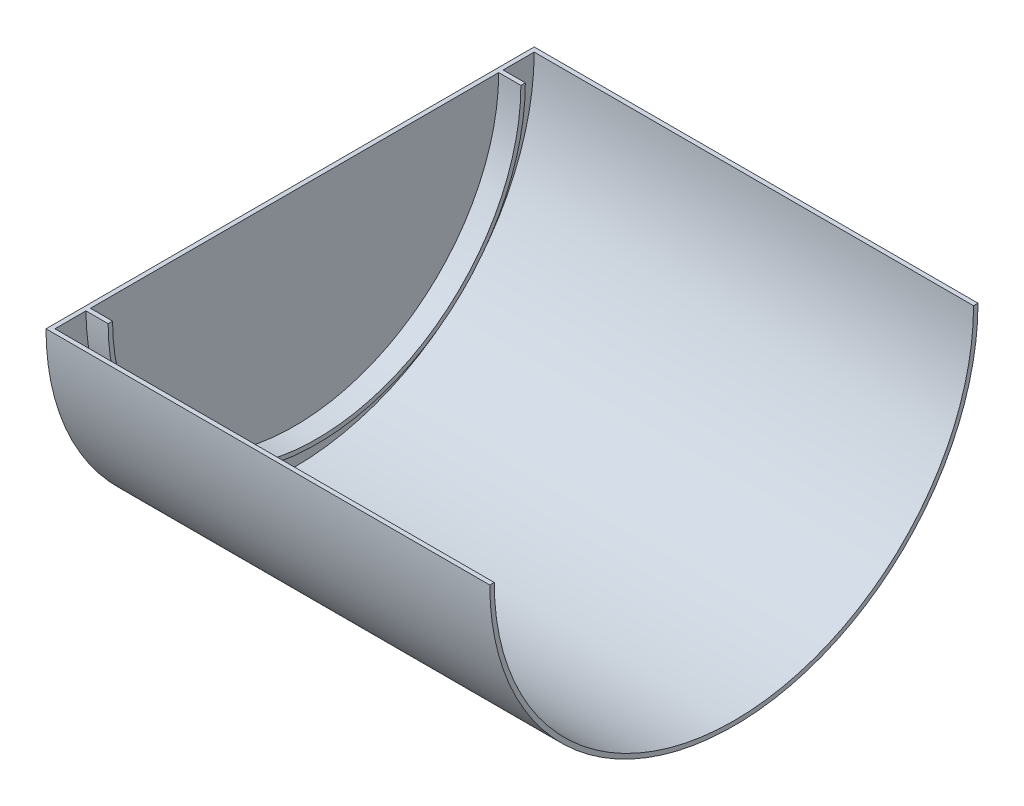
from build123d import *

# Parameters (mm, degrees)
BOSS_EXTRUDE2_DEPTH = 100
CUT_EXTRUDE1_DEPTH  = 99
EXTRUDE_THIN1_DEPTH = 5


with BuildPart() as part:
    # Sketch1 → Boss-Extrude2 (new body)
    with BuildSketch(Plane(origin=(0, 0, 0), x_dir=(0, 0, -1), z_dir=(1, 0, 0))):
        with BuildLine():
            Line((-55, 0), (55, 0))
            ThreePointArc((55, 0), (0, -55), (-55, 0))
        make_face()
    extrude(amount=BOSS_EXTRUDE2_DEPTH)

    # Sketch5 → Cut-Extrude1 (cut)
    with BuildSketch(Plane(origin=(100, 0, 0), x_dir=(0, 0, -1), z_dir=(1, 0, 0))):
        with BuildLine():
            Line((-54, 0), (54, 0))
            ThreePointArc((54, 0), (0, -54), (-54, 0))
        make_face()
    extrude(amount=-CUT_EXTRUDE1_DEPTH, mode=Mode.SUBTRACT)

    # Sketch6 → Extrude-Thin1 (add)
    with BuildSketch(Plane(origin=(1, 0, 0), x_dir=(0, 0, -1), z_dir=(1, 0, 0))):
        with BuildLine():
            ThreePointArc((47, 0), (0, -47), (-47, 0))
            Line((-47, 0), (-46, 0))
            ThreePointArc((-46, 0), (0, -46), (46, 0))
            Line((46, 0), (47, 0))
        make_face()
    extrude(amount=EXTRUDE_THIN1_DEPTH)


solid = part.part
